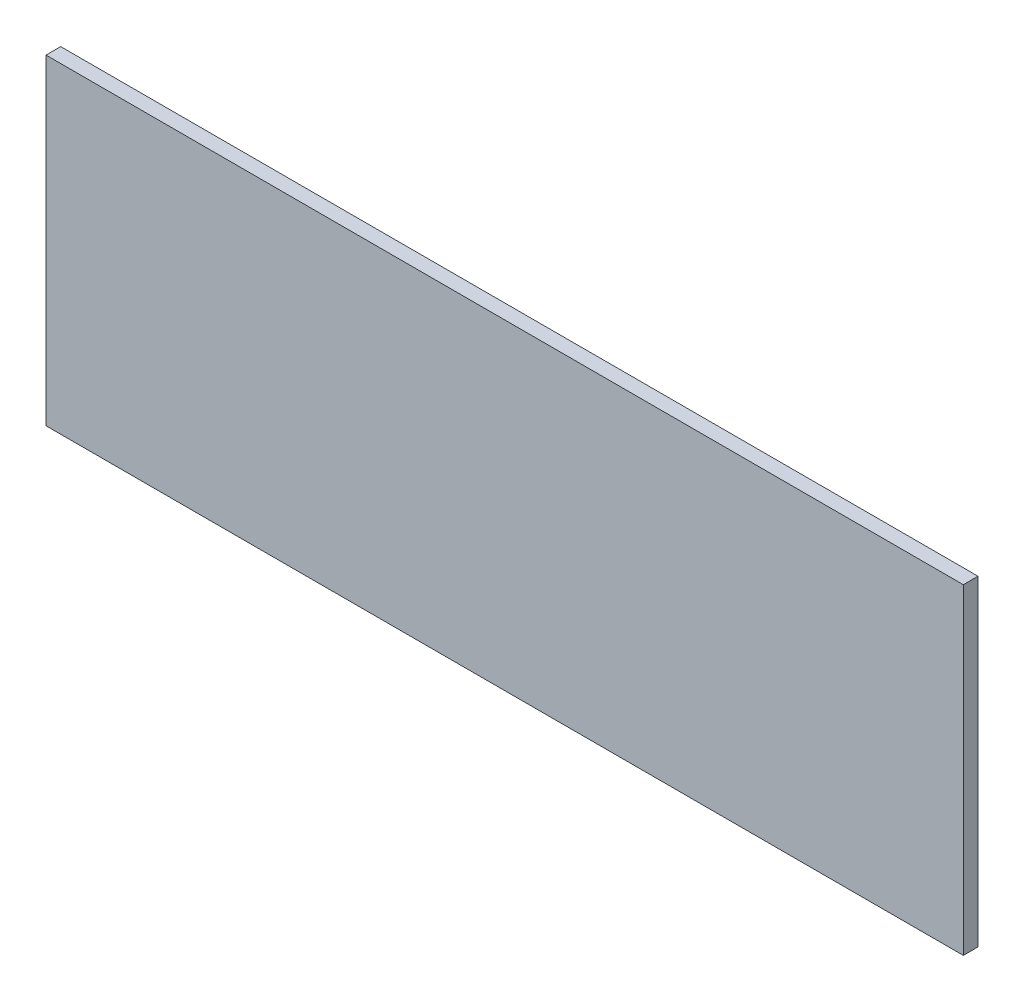
from build123d import *

# Parameters (mm, degrees)
SKETCH_1_W      = 50
SKETCH_1_H      = 17.5
EXTRUDE_1_DEPTH = 0.8


with BuildPart() as part:
    # 草图1 → 凸台-拉伸1 (new body)
    with BuildSketch(Plane.XY):
        with Locations((-21.871935867, -5.54522911)):
            Rectangle(SKETCH_1_W, SKETCH_1_H)
    extrude(amount=EXTRUDE_1_DEPTH)


solid = part.part
